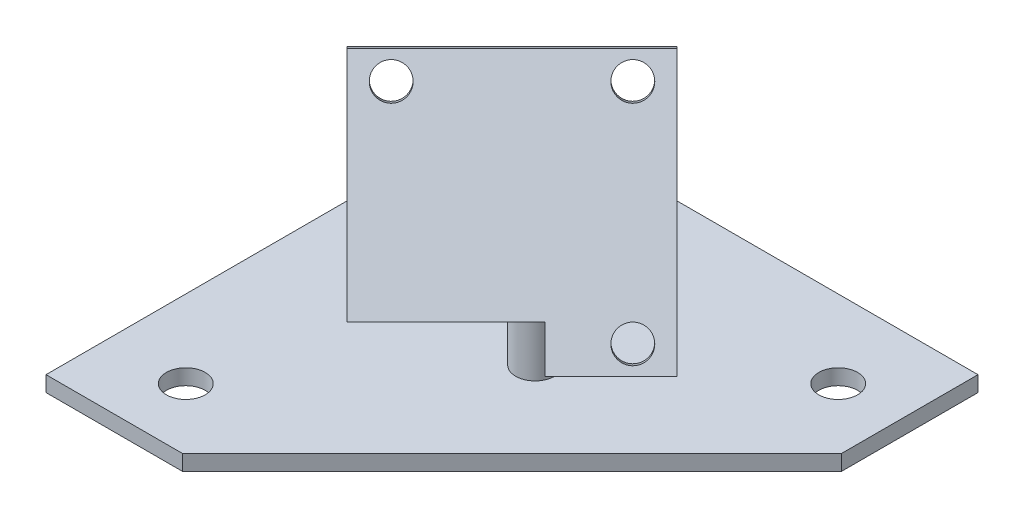
from build123d import *

# Parameters (mm, degrees)
SKETCH_1_R      = 2.5
EXTRUDE_1_DEPTH = 2
SKETCH_2_R      = 2
EXTRUDE_3_DEPTH = 2
EXTRUDE_4_REACH = 93.122
SKETCH_4_R      = 2.5


with BuildPart() as part:
    # 草图1 → 凸台-拉伸1 (new body)
    with BuildSketch(Plane(origin=(0, 0, 0), x_dir=(1, 0, 0), z_dir=(0, 1, 0))):
        Polygon((17.573593129, -60), (60, -17.573593129), (60, 0), (20, 0), (20, -20), (0, -20), (0, -60), align=None)
        with Locations(Location((10, -52, 0), (0, 0, 270))):
            Circle(SKETCH_1_R, mode=Mode.SUBTRACT)
        with Locations(Location((52, -10, 0), (0, 0, 270))):
            Circle(SKETCH_1_R, mode=Mode.SUBTRACT)
    extrude(amount=EXTRUDE_1_DEPTH)



with BuildPart() as body_2:
    # 草图2 → 凸台-拉伸3 (new body)
    with BuildSketch(Plane(origin=(29.702469859, 24.251965085, 29.702469859), x_dir=(-0.7071067811865476, 0, 0.7071067811865476), z_dir=(0.6123724356957954, 0.499999999999998, 0.6123724356957954))):
        Polygon((-3, 18.4959816), (-15, 18.4959816), (-15, -11.5040184), (15, -11.5040184), (15, 13.4959816), (11, 13.4959816), (-3, 13.4959816), align=None)
        with Locations(Location((-11, -8.5040184, 0), (0, 0, 180))):
            Circle(SKETCH_2_R, mode=Mode.SUBTRACT)
        with Locations(Location((11, -8.5040184, 0), (0, 0, 180))):
            Circle(SKETCH_2_R, mode=Mode.SUBTRACT)
        with Locations(Location((-11, 15.4959816, 0), (0, 0, 180))):
            Circle(SKETCH_2_R, mode=Mode.SUBTRACT)
    extrude(amount=EXTRUDE_3_DEPTH)


with BuildPart() as part_1:
    add(part.part)

    add(body_2.part)  # 凸台-拉伸4 merges body 2
    # 凸台-拉伸4: up to this plane
    extrude_4_end = Plane(origin=(29.702469859, 24.251965085, 29.702469859), z_dir=(0.6123724356957954, 0.499999999999998, 0.6123724356957954))
    # 草图4 → 凸台-拉伸4 (add, up to the surface)
    with BuildSketch(Plane(origin=(0, 2, 0), x_dir=(1, 0, 0), z_dir=(0, 1, 0)), mode=Mode.PRIVATE) as extrude_4_sk1:
        with Locations(Location((30.42692979, -27.445922357, 0), (0, 0, 315))):
            Circle(SKETCH_4_R)
    extrude_4_tool1 = split(extrude(extrude_4_sk1.sketch, amount=EXTRUDE_4_REACH, mode=Mode.PRIVATE), bisect_by=extrude_4_end, keep=Keep.BOTH, mode=Mode.PRIVATE)
    add(extrude_4_tool1.solids().sort_by_distance((30.42693, 2, 27.445922))[0])


solid = part_1.part
